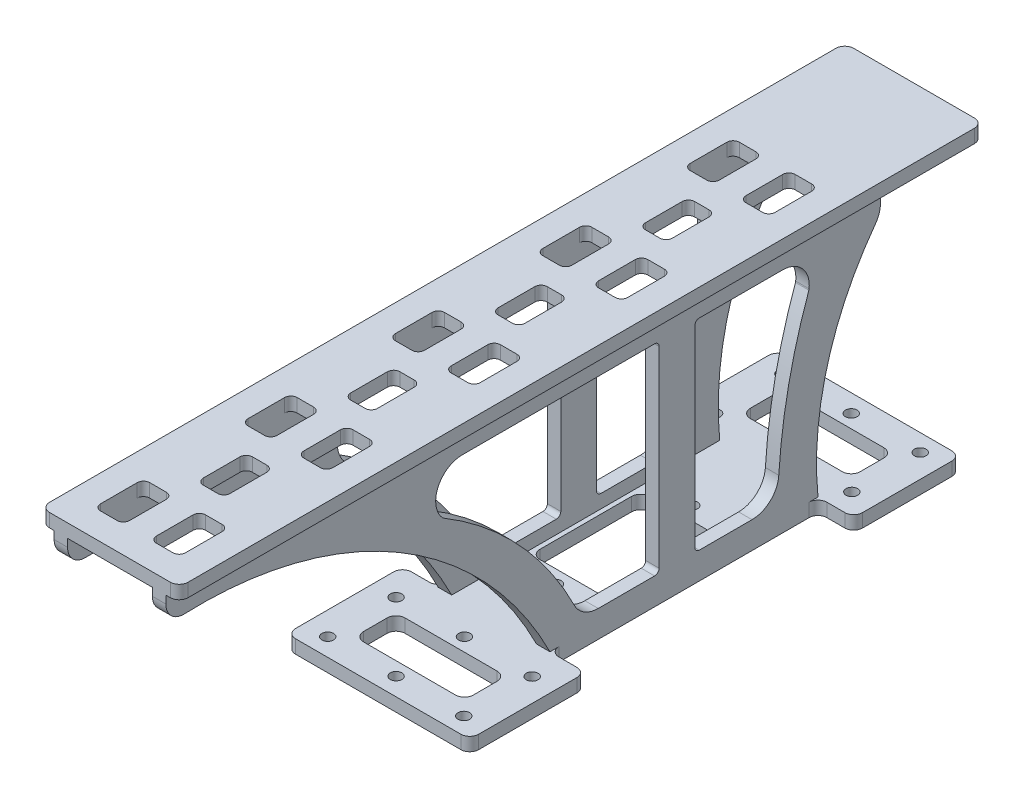
from build123d import *

# Parameters (mm, degrees)
BOSS_EXTRUDE1_DEPTH = 650
SKETCH3_R           = 6.5
CUT_EXTRUDE2_DEPTH  = 50
SKETCH13_W          = 155
SKETCH13_H          = 15
BOSS_EXTRUDE4_DEPTH = 250
SKETCH15_W          = 650
SKETCH15_H          = 270
CUT_EXTRUDE9_DEPTH  = 250
BOSS_EXTRUDE5_DEPTH = 15
SKETCH19_W          = 205
SKETCH19_H          = 50.25
CUT_EXTRUDE10_DEPTH = 20
SKETCH20_W          = 40
SKETCH20_H          = 300
CUT_EXTRUDE12_DEPTH = 20
CUT_EXTRUDE14_DEPTH = 963.925230742
FILLET1_R           = 20
FILLET2_R           = 30
CUT_EXTRUDE15_DEPTH = 20
CUT_EXTRUDE16_DEPTH = 20
FILLET4_R           = 10
FILLET5_R           = 10
SKETCH25_W          = 40
SKETCH25_H          = 225
BOSS_EXTRUDE6_DEPTH = 15
FILLET6_R           = 5
FILLET7_R           = 5


with BuildPart() as part:
    # Sketch1 → Boss-Extrude1 (new body)
    with BuildSketch(Plane.XY):
        Polygon((0, 0), (205, 0), (205, 15), (180, 15), (180, 300), (25, 300), (25, 15), (0, 15), align=None)
    extrude(amount=BOSS_EXTRUDE1_DEPTH)

    # Sketch3 → Cut-Extrude2 (cut)
    with BuildSketch(Plane.XZ):
        with Locations(Location((26, 70.25, 0), (0, 0, 270))):
            Circle(SKETCH3_R)
        with Locations(Location((102.5, 70.25, 0), (0, 0, 270))):
            Circle(SKETCH3_R)
        with Locations(Location((178.997046872, 69.577824518, 0), (0, 0, 270))):
            Circle(SKETCH3_R)
        with Locations(Location((178.997046872, 146.077824518, 0), (0, 0, 270))):
            Circle(SKETCH3_R)
        with Locations(Location((102.5, 146.75, 0), (0, 0, 270))):
            Circle(SKETCH3_R)
        with Locations(Location((26, 146.75, 0), (0, 0, 270))):
            Circle(SKETCH3_R)
        with Locations(Location((26, 248.75, 0), (0, 0, 270))):
            Circle(SKETCH3_R)
        with Locations(Location((102.5, 248.75, 0), (0, 0, 270))):
            Circle(SKETCH3_R)
        with Locations(Location((102.5, 401.25, 0), (0, 0, 90))):
            Circle(SKETCH3_R)
        with Locations(Location((102.5, 503.25, 0), (0, 0, 90))):
            Circle(SKETCH3_R)
        with Locations(Location((178.997046872, 503.922175482, 0), (0, 0, 278.876228723))):
            Circle(SKETCH3_R)
        with Locations(Location((178.997046872, 580.422175482, 0), (0, 0, 278.876228723))):
            Circle(SKETCH3_R)
        with Locations(Location((102.5, 579.75, 0), (0, 0, 90))):
            Circle(SKETCH3_R)
        with Locations(Location((26, 401.25, 0), (0, 0, 261.150116902))):
            Circle(SKETCH3_R)
        with Locations(Location((26, 503.25, 0), (0, 0, 261.150116902))):
            Circle(SKETCH3_R)
        with Locations(Location((26, 579.75, 0), (0, 0, 261.150116902))):
            Circle(SKETCH3_R)
    extrude(amount=-CUT_EXTRUDE2_DEPTH, mode=Mode.SUBTRACT)

    # Sketch13 → Boss-Extrude4 (add)
    with BuildSketch(Plane.XY.offset(650)):
        with Locations((102.5, 292.5)):
            Rectangle(SKETCH13_W, SKETCH13_H)
    extrude(amount=BOSS_EXTRUDE4_DEPTH)

    # Sketch15 → Cut-Extrude9 (cut)
    with BuildSketch(Plane(origin=(205, 0, 0), x_dir=(0, 0, -1), z_dir=(1, 0, 0))):
        with Locations((-325, 150)):
            Rectangle(SKETCH15_W, SKETCH15_H)
    extrude(amount=-CUT_EXTRUDE9_DEPTH, mode=Mode.SUBTRACT)


with BuildPart() as cut_extrude9_piece_1:
    # of the separate pieces the step leaves, piece 1, a body of its own (cut_extrude9_pieces)
    add(part.part.solids().sort_by_distance((25, 300, 0))[0])



with BuildPart() as cut_extrude9_piece_2:
    # of the separate pieces the step leaves, piece 2, a body of its own (cut_extrude9_pieces)
    add(part.part.solids().sort_by_distance((0, 0, 0))[0])


with BuildPart() as cut_extrude9_piece_1_1:
    add(cut_extrude9_piece_1.part)

    add(cut_extrude9_piece_2.part)  # Boss-Extrude5 merges Cut-Extrude9 piece 2
    # Sketch17 → Boss-Extrude5 (add)
    with BuildSketch(Plane.ZY.offset(-40)):
        with BuildLine():
            Line((100, 285), (100, 255))
            ThreePointArc((100, 255), (158.295883563, 141.794632706), (170, 15))
            Line((170, 15), (470, 15))
            ThreePointArc((470, 15), (648.122253507, 201.072629133), (900, 255))
            Line((900, 255), (900, 285))
            Line((900, 285), (100, 285))
        make_face()
    boss_extrude5 = extrude(amount=-BOSS_EXTRUDE5_DEPTH)

    # Mirror5: Boss-Extrude5 across plane
    add(boss_extrude5.mirror(Plane.ZY.offset(-102.5)))

    # Sketch19 → Cut-Extrude10 (cut)
    with BuildSketch(Plane.XZ):
        with Locations((102.5, 25.125)):
            Rectangle(SKETCH19_W, SKETCH19_H)
        with Locations((102.5, 624.875)):
            Rectangle(SKETCH19_W, SKETCH19_H)
    extrude(amount=-CUT_EXTRUDE10_DEPTH, mode=Mode.SUBTRACT)

    # Sketch20 → Cut-Extrude12 (cut)
    with BuildSketch(Plane(origin=(0, 15, 0), x_dir=(1, 0, 0), z_dir=(0, 1, 0))):
        with Locations((20, -320)):
            Rectangle(SKETCH20_W, SKETCH20_H)
        with Locations((185, -320)):
            Rectangle(SKETCH20_W, SKETCH20_H)
    extrude(amount=-CUT_EXTRUDE12_DEPTH, mode=Mode.SUBTRACT)

    # Sketch22 → Cut-Extrude14 (cut, through all)
    with BuildSketch(Plane.ZY.offset(-40)):
        with BuildLine():
            Line((243.825576639, 30), (415.968410663, 30))
            ThreePointArc((415.968410663, 30), (431.740317463, 34.480459332), (442.801198462, 46.583536273))
            ThreePointArc((442.801198462, 46.583536273), (505.01571743, 136.227582601), (590, 204.670063038))
            ThreePointArc((590, 204.670063038), (595.415201589, 237.043709793), (567.938865326, 255))
            Line((567.938865326, 255), (209.754316473, 255))
            ThreePointArc((209.754316473, 255), (187.227154937, 244.812293989), (180, 221.168466208))
            ThreePointArc((180, 221.168466208), (202.719169831, 140.833662545), (213.885913602, 58.098269931))
            ThreePointArc((213.885913602, 58.098269931), (223.295743493, 38.124763978), (243.825576639, 30))
        make_face()
    extrude(amount=-CUT_EXTRUDE14_DEPTH, mode=Mode.SUBTRACT)

    # Fillet1
    fillet1_edges = [cut_extrude9_piece_1_1.edges().sort_by_distance(p)[0] for p in [
        (47.5, 255, 900),
        (157.5, 255, 900),
    ]]
    fillet(fillet1_edges, radius=FILLET1_R)

    # Fillet2
    fillet2_edges = [cut_extrude9_piece_1_1.edges().sort_by_distance(p)[0] for p in [
        (47.5, 255, 100),
        (157.5, 255, 100),
    ]]
    fillet(fillet2_edges, radius=FILLET2_R)

    # Sketch24 → Cut-Extrude15 (cut)
    with BuildSketch(Plane(origin=(0, 300, 0), x_dir=(1, 0, 0), z_dir=(0, 1, 0))):
        with BuildLine():
            Line((143, -870), (124.5, -870))
            ThreePointArc((124.5, -870), (119.550252532, -867.949747468), (117.5, -863))
            Line((117.5, -863), (117.5, -822))
            ThreePointArc((117.5, -822), (119.550252532, -817.050252532), (124.5, -815))
            Line((124.5, -815), (143, -815))
            ThreePointArc((143, -815), (147.949747468, -817.050252532), (150, -822))
            Line((150, -822), (150, -863))
            ThreePointArc((150, -863), (147.949747468, -867.949747468), (143, -870))
        make_face()
        with BuildLine():
            Line((62, -870), (80.5, -870))
            ThreePointArc((80.5, -870), (85.449747468, -867.949747468), (87.5, -863))
            Line((87.5, -863), (87.5, -822))
            ThreePointArc((87.5, -822), (85.449747468, -817.050252532), (80.5, -815))
            Line((80.5, -815), (62, -815))
            ThreePointArc((62, -815), (57.050252532, -817.050252532), (55, -822))
            Line((55, -822), (55, -863))
            ThreePointArc((55, -863), (57.050252532, -867.949747468), (62, -870))
        make_face()
        with BuildLine():
            Line((55, -698), (55, -657))
            ThreePointArc((55, -657), (57.050252532, -652.050252532), (62, -650))
            Line((62, -650), (80.5, -650))
            ThreePointArc((80.5, -650), (85.449747468, -652.050252532), (87.5, -657))
            Line((87.5, -657), (87.5, -698))
            ThreePointArc((87.5, -698), (85.449747468, -702.949747468), (80.5, -705))
            Line((80.5, -705), (62, -705))
            ThreePointArc((62, -705), (57.050252532, -702.949747468), (55, -698))
        make_face()
        with BuildLine():
            Line((150, -698), (150, -657))
            ThreePointArc((150, -657), (147.949747468, -652.050252532), (143, -650))
            Line((143, -650), (124.5, -650))
            ThreePointArc((124.5, -650), (119.550252532, -652.050252532), (117.5, -657))
            Line((117.5, -657), (117.5, -698))
            ThreePointArc((117.5, -698), (119.550252532, -702.949747468), (124.5, -705))
            Line((124.5, -705), (143, -705))
            ThreePointArc((143, -705), (147.949747468, -702.949747468), (150, -698))
        make_face()
        with BuildLine():
            Line((55, -533), (55, -492))
            ThreePointArc((55, -492), (57.050252532, -487.050252532), (62, -485))
            Line((62, -485), (80.5, -485))
            ThreePointArc((80.5, -485), (85.449747468, -487.050252532), (87.5, -492))
            Line((87.5, -492), (87.5, -533))
            ThreePointArc((87.5, -533), (85.449747468, -537.949747468), (80.5, -540))
            Line((80.5, -540), (62, -540))
            ThreePointArc((62, -540), (57.050252532, -537.949747468), (55, -533))
        make_face()
        with BuildLine():
            Line((150, -533), (150, -492))
            ThreePointArc((150, -492), (147.949747468, -487.050252532), (143, -485))
            Line((143, -485), (124.5, -485))
            ThreePointArc((124.5, -485), (119.550252532, -487.050252532), (117.5, -492))
            Line((117.5, -492), (117.5, -533))
            ThreePointArc((117.5, -533), (119.550252532, -537.949747468), (124.5, -540))
            Line((124.5, -540), (143, -540))
            ThreePointArc((143, -540), (147.949747468, -537.949747468), (150, -533))
        make_face()
        with BuildLine():
            Line((55, -368), (55, -327))
            ThreePointArc((55, -327), (57.050252532, -322.050252532), (62, -320))
            Line((62, -320), (80.5, -320))
            ThreePointArc((80.5, -320), (85.449747468, -322.050252532), (87.5, -327))
            Line((87.5, -327), (87.5, -368))
            ThreePointArc((87.5, -368), (85.449747468, -372.949747468), (80.5, -375))
            Line((80.5, -375), (62, -375))
            ThreePointArc((62, -375), (57.050252532, -372.949747468), (55, -368))
        make_face()
        with BuildLine():
            Line((150, -368), (150, -327))
            ThreePointArc((150, -327), (147.949747468, -322.050252532), (143, -320))
            Line((143, -320), (124.5, -320))
            ThreePointArc((124.5, -320), (119.550252532, -322.050252532), (117.5, -327))
            Line((117.5, -327), (117.5, -368))
            ThreePointArc((117.5, -368), (119.550252532, -372.949747468), (124.5, -375))
            Line((124.5, -375), (143, -375))
            ThreePointArc((143, -375), (147.949747468, -372.949747468), (150, -368))
        make_face()
        with BuildLine():
            Line((55, -203), (55, -162))
            ThreePointArc((55, -162), (57.050252532, -157.050252532), (62, -155))
            Line((62, -155), (80.5, -155))
            ThreePointArc((80.5, -155), (85.449747468, -157.050252532), (87.5, -162))
            Line((87.5, -162), (87.5, -203))
            ThreePointArc((87.5, -203), (85.449747468, -207.949747468), (80.5, -210))
            Line((80.5, -210), (62, -210))
            ThreePointArc((62, -210), (57.050252532, -207.949747468), (55, -203))
        make_face()
        with BuildLine():
            Line((150, -203), (150, -162))
            ThreePointArc((150, -162), (147.949747468, -157.050252532), (143, -155))
            Line((143, -155), (124.5, -155))
            ThreePointArc((124.5, -155), (119.550252532, -157.050252532), (117.5, -162))
            Line((117.5, -162), (117.5, -203))
            ThreePointArc((117.5, -203), (119.550252532, -207.949747468), (124.5, -210))
            Line((124.5, -210), (143, -210))
            ThreePointArc((143, -210), (147.949747468, -207.949747468), (150, -203))
        make_face()
        with BuildLine():
            Line((117.5, -574.5), (117.5, -615.5))
            ThreePointArc((117.5, -615.5), (115.449747468, -620.449747468), (110.5, -622.5))
            Line((110.5, -622.5), (94.5, -622.5))
            ThreePointArc((94.5, -622.5), (89.550252532, -620.449747468), (87.5, -615.5))
            Line((87.5, -615.5), (87.5, -574.5))
            ThreePointArc((87.5, -574.5), (89.550252532, -569.550252532), (94.5, -567.5))
            Line((94.5, -567.5), (110.5, -567.5))
            ThreePointArc((110.5, -567.5), (115.449747468, -569.550252532), (117.5, -574.5))
        make_face()
        with BuildLine():
            Line((110.5, -732.5), (94.5, -732.5))
            ThreePointArc((94.5, -732.5), (89.550252532, -734.550252532), (87.5, -739.5))
            Line((87.5, -739.5), (87.5, -780.5))
            ThreePointArc((87.5, -780.5), (89.550252532, -785.449747468), (94.5, -787.5))
            Line((94.5, -787.5), (110.5, -787.5))
            ThreePointArc((110.5, -787.5), (115.449747468, -785.449747468), (117.5, -780.5))
            Line((117.5, -780.5), (117.5, -739.5))
            ThreePointArc((117.5, -739.5), (115.449747468, -734.550252532), (110.5, -732.5))
        make_face()
        with BuildLine():
            Line((117.5, -409.5), (117.5, -450.5))
            ThreePointArc((117.5, -450.5), (115.449747468, -455.449747468), (110.5, -457.5))
            Line((110.5, -457.5), (94.5, -457.5))
            ThreePointArc((94.5, -457.5), (89.550252532, -455.449747468), (87.5, -450.5))
            Line((87.5, -450.5), (87.5, -409.5))
            ThreePointArc((87.5, -409.5), (89.550252532, -404.550252532), (94.5, -402.5))
            Line((94.5, -402.5), (110.5, -402.5))
            ThreePointArc((110.5, -402.5), (115.449747468, -404.550252532), (117.5, -409.5))
        make_face()
        with BuildLine():
            Line((117.5, -244.5), (117.5, -285.5))
            ThreePointArc((117.5, -285.5), (115.449747468, -290.449747468), (110.5, -292.5))
            Line((110.5, -292.5), (94.5, -292.5))
            ThreePointArc((94.5, -292.5), (89.550252532, -290.449747468), (87.5, -285.5))
            Line((87.5, -285.5), (87.5, -244.5))
            ThreePointArc((87.5, -244.5), (89.550252532, -239.550252532), (94.5, -237.5))
            Line((94.5, -237.5), (110.5, -237.5))
            ThreePointArc((110.5, -237.5), (115.449747468, -239.550252532), (117.5, -244.5))
        make_face()
    extrude(amount=-CUT_EXTRUDE15_DEPTH, mode=Mode.SUBTRACT)

    # Sketch21 → Cut-Extrude16 (cut)
    with BuildSketch(Plane.XZ):
        with BuildLine():
            ThreePointArc((51, 85.25), (43.928932188, 88.178932188), (41, 95.25))
            Line((41, 95.25), (41, 121.75))
            ThreePointArc((41, 121.75), (43.928932188, 128.821067812), (51, 131.75))
            Line((51, 131.75), (153.997046872, 131.75))
            ThreePointArc((153.997046872, 131.75), (161.068114684, 128.821067812), (163.997046872, 121.75))
            Line((163.997046872, 121.75), (163.997046872, 95.25))
            ThreePointArc((163.997046872, 95.25), (161.068114684, 88.178932188), (153.997046872, 85.25))
            Line((153.997046872, 85.25), (51, 85.25))
        make_face()
        with BuildLine():
            ThreePointArc((70, 263.75), (62.928932188, 266.678932188), (60, 273.75))
            Line((60, 273.75), (60, 376.25))
            ThreePointArc((60, 376.25), (62.928932188, 383.321067812), (70, 386.25))
            Line((70, 386.25), (135, 386.25))
            ThreePointArc((135, 386.25), (142.071067812, 383.321067812), (145, 376.25))
            Line((145, 376.25), (145, 273.75))
            ThreePointArc((145, 273.75), (142.071067812, 266.678932188), (135, 263.75))
            Line((135, 263.75), (70, 263.75))
        make_face()
        with BuildLine():
            ThreePointArc((51, 518.25), (43.928932188, 521.178932188), (41, 528.25))
            Line((41, 528.25), (41, 554.75))
            ThreePointArc((41, 554.75), (43.928932188, 561.821067812), (51, 564.75))
            Line((51, 564.75), (153.997046872, 564.75))
            ThreePointArc((153.997046872, 564.75), (161.068114684, 561.821067812), (163.997046872, 554.75))
            Line((163.997046872, 554.75), (163.997046872, 528.25))
            ThreePointArc((163.997046872, 528.25), (161.068114684, 521.178932188), (153.997046872, 518.25))
            Line((153.997046872, 518.25), (51, 518.25))
        make_face()
    extrude(amount=-CUT_EXTRUDE16_DEPTH, mode=Mode.SUBTRACT)

    # Fillet4
    fillet4_edges = [cut_extrude9_piece_1_1.edges().sort_by_distance(p)[0] for p in [
        (40, 7.5, 170),
        (40, 7.5, 470),
        (0, 7.5, 470),
        (0, 7.5, 170),
        (165, 7.5, 170),
        (205, 7.5, 170),
        (205, 7.5, 470),
        (165, 7.5, 470),
        (205, 7.5, 50.25),
        (0, 7.5, 50.25),
        (205, 7.5, 599.75),
        (0, 7.5, 599.75),
    ]]
    fillet(fillet4_edges, radius=FILLET4_R)

    # Fillet5
    fillet5_edges = [cut_extrude9_piece_1_1.edges().sort_by_distance(p)[0] for p in [
        (180, 292.5, 0),
        (25, 292.5, 0),
        (25, 292.5, 900),
        (180, 292.5, 900),
    ]]
    fillet(fillet5_edges, radius=FILLET5_R)

    # Sketch25 → Boss-Extrude6 (add)
    with BuildSketch(Plane.ZY.offset(-40)):
        with Locations((327.885913602, 142.5)):
            Rectangle(SKETCH25_W, SKETCH25_H)
    boss_extrude6 = extrude(amount=-BOSS_EXTRUDE6_DEPTH)

    # Fillet6
    fillet6_edges = [cut_extrude9_piece_1_1.edges().sort_by_distance(p)[0] for p in [
        (47.5, 255, 347.885913602),
        (47.5, 30, 347.885913602),
        (47.5, 30, 307.885913602),
        (47.5, 255, 307.885913602),
        (47.5, 221.168466208, 180),
        (47.5, 204.670063038, 590),
    ]]
    fillet(fillet6_edges, radius=FILLET6_R)

    # Mirror6: Boss-Extrude6 across plane
    add(boss_extrude6.mirror(Plane.ZY.offset(-102.5)))

    # Fillet7
    fillet7_edges = [cut_extrude9_piece_1_1.edges().sort_by_distance(p)[0] for p in [
        (157.5, 30, 347.885913602),
        (157.5, 255, 347.885913602),
        (157.5, 255, 307.885913602),
        (157.5, 30, 307.885913602),
        (157.5, 221.168466208, 180),
        (157.5, 204.670063038, 590),
    ]]
    fillet(fillet7_edges, radius=FILLET7_R)


solid = cut_extrude9_piece_1_1.part
